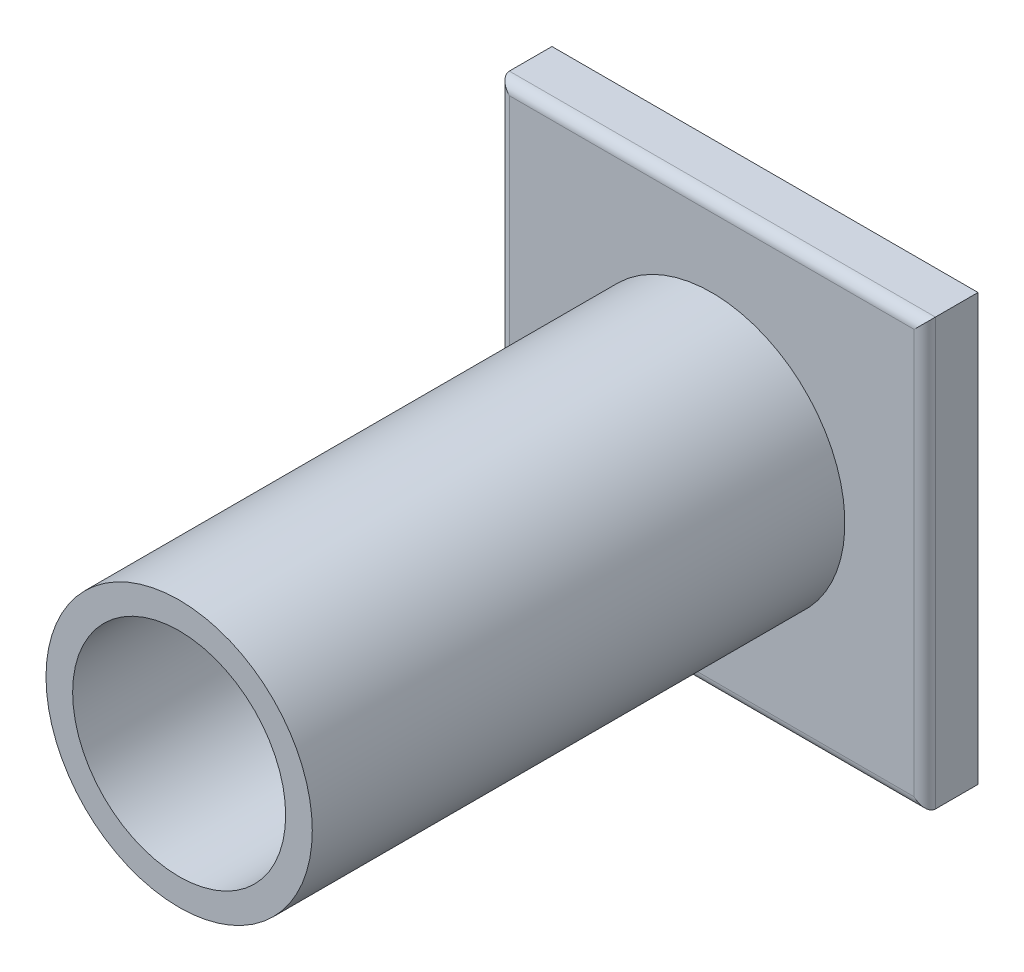
from build123d import *

# Parameters (mm, degrees)
SKETCH1_W           = 800
SKETCH1_H           = 800
BOSS_EXTRUDE1_DEPTH = 100
SKETCH2_R           = 250
SKETCH2_R_2         = 200
BOSS_EXTRUDE2_DEPTH = 1000
FILLET1_R           = 20


with BuildPart() as part:
    # Sketch1 → Boss-Extrude1 (new body)
    with BuildSketch(Plane.XY):
        Rectangle(SKETCH1_W, SKETCH1_H)
    extrude(amount=BOSS_EXTRUDE1_DEPTH)

    # Sketch2 → Boss-Extrude2 (add)
    with BuildSketch(Plane.XY.offset(100)):
        with Locations(Location((0, 0, 0), (0, 0, 180))):
            Circle(SKETCH2_R)
        Circle(SKETCH2_R_2, mode=Mode.SUBTRACT)
    extrude(amount=BOSS_EXTRUDE2_DEPTH)

    # Fillet1
    fillet1_edges = [part.edges().sort_by_distance(p)[0] for p in [
        (-400, 0, 100),
        (0, -400, 100),
        (400, 0, 100),
        (0, 400, 100),
    ]]
    fillet(fillet1_edges, radius=FILLET1_R)


solid = part.part
